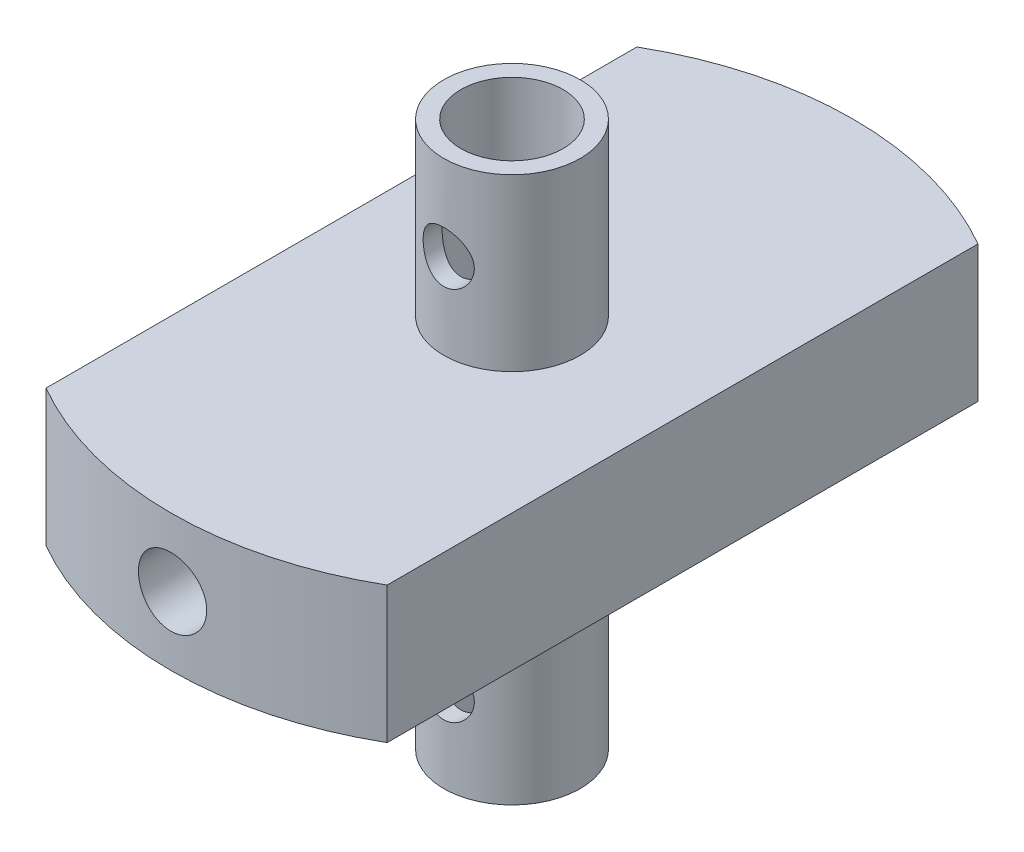
from build123d import *

# Parameters (mm, degrees)
SKETCH2_R               = 4
SKETCH2_R_2             = 3
BOSS_EXTRUDE1_DEPTH     = 10
CUT_EXTRUDE1_DEPTH      = 45.72135955
CUT_EXTRUDE1_DEPTH_BACK = 45.72135955
SKETCH3_R               = 1.5
SKETCH3_R_2             = 2
SKETCH4_W               = 20
SKETCH4_H               = 45
CUT_EXTRUDE2_DEPTH      = 10


with BuildPart() as part:
    # Sketch1 → Revolve1 (revolve)
    with BuildSketch(Plane.XY, mode=Mode.PRIVATE) as revolve1_sk:
        Polygon((3, 0), (4, 0), (4, 14), (20, 14), (20, 22), (0, 22), (0, 13), (3, 13), align=None)
    revolve(revolve1_sk.sketch.rotate(Axis((0, 0, 0), (0, 1, 0)), 90), axis=Axis((0, 0, 0), (0, 1, 0)))

    # Sketch2 → Boss-Extrude1 (add)
    with BuildSketch(Plane(origin=(0, 22, 0), x_dir=(1, 0, 0), z_dir=(0, 1, 0))):
        with Locations(Location((0, 0, 0), (0, 0, 90))):
            Circle(SKETCH2_R)
        with Locations(Location((0, 0, 0), (0, 0, 90))):
            Circle(SKETCH2_R_2, mode=Mode.SUBTRACT)
    extrude(amount=BOSS_EXTRUDE1_DEPTH)

    # Sketch3 → Cut-Extrude1 (cut, two sides: drawn at the far end of the back side and taken through both)
    with BuildSketch(Plane(origin=(0, 0, -4), x_dir=(-1, 0, 0), z_dir=(0, 0, -1)).offset(-CUT_EXTRUDE1_DEPTH_BACK)):
        with Locations((0, 5)):
            Circle(SKETCH3_R)
        with Locations((0, 27)):
            Circle(SKETCH3_R)
        with Locations((0, 18)):
            Circle(SKETCH3_R_2)
    extrude(amount=CUT_EXTRUDE1_DEPTH + CUT_EXTRUDE1_DEPTH_BACK, mode=Mode.SUBTRACT)

    # Sketch4 → Cut-Extrude2 (cut)
    with BuildSketch(Plane.XZ.offset(-14)):
        with Locations((-20, 0)):
            Rectangle(SKETCH4_W, SKETCH4_H)
        with Locations((20, 0)):
            Rectangle(SKETCH4_W, SKETCH4_H)
    extrude(amount=-CUT_EXTRUDE2_DEPTH, mode=Mode.SUBTRACT)


solid = part.part
